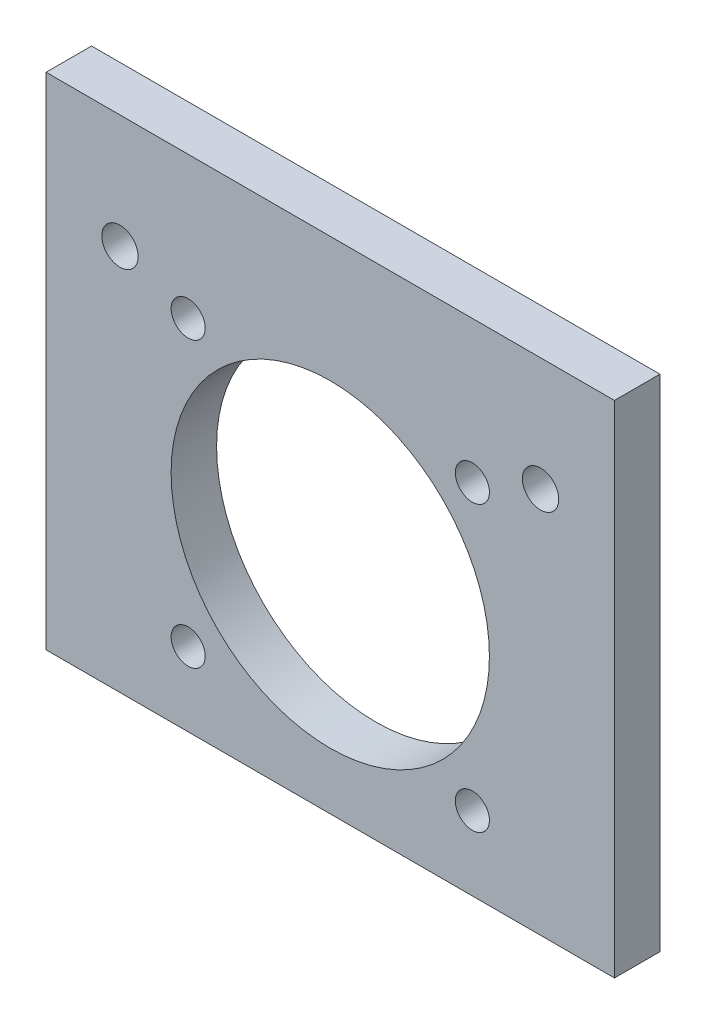
from build123d import *

# Parameters (mm, degrees)
SKETCH1_W             = 50
SKETCH1_H             = 44
BOSS_EXTRUDE1_DEPTH   = 4
F_3_0MM_DOWEL_HOLE1_D = 3.2
SKETCH4_R             = 14
CUT_EXTRUDE1_DEPTH    = 4
F_3_0MM_DOWEL_HOLE2_D = 3


with BuildPart() as part:
    # Sketch1 → Boss-Extrude1 (new body)
    with BuildSketch(Plane.XY):
        with Locations((25, 22)):
            Rectangle(SKETCH1_W, SKETCH1_H)
    extrude(amount=BOSS_EXTRUDE1_DEPTH)

    # Ø3.0mm Dowel Hole1 (through all)
    with Locations(Plane.XY.offset(4)):
        with Locations((6.5, 34), (43.5, 34)):
            Hole(F_3_0MM_DOWEL_HOLE1_D / 2)

    # Sketch4 → Cut-Extrude1 (cut)
    with BuildSketch(Plane.XY.offset(4)):
        with Locations((25, 19)):
            Circle(SKETCH4_R)
    extrude(amount=-CUT_EXTRUDE1_DEPTH, mode=Mode.SUBTRACT)

    # Ø3.0mm Dowel Hole2 (through all)
    with Locations(Plane.XY.offset(4)):
        with Locations((12.5, 31.5), (25, 19), (37.5, 31.5), (37.5, 6.5), (12.5, 6.5)):
            Hole(F_3_0MM_DOWEL_HOLE2_D / 2)


solid = part.part
